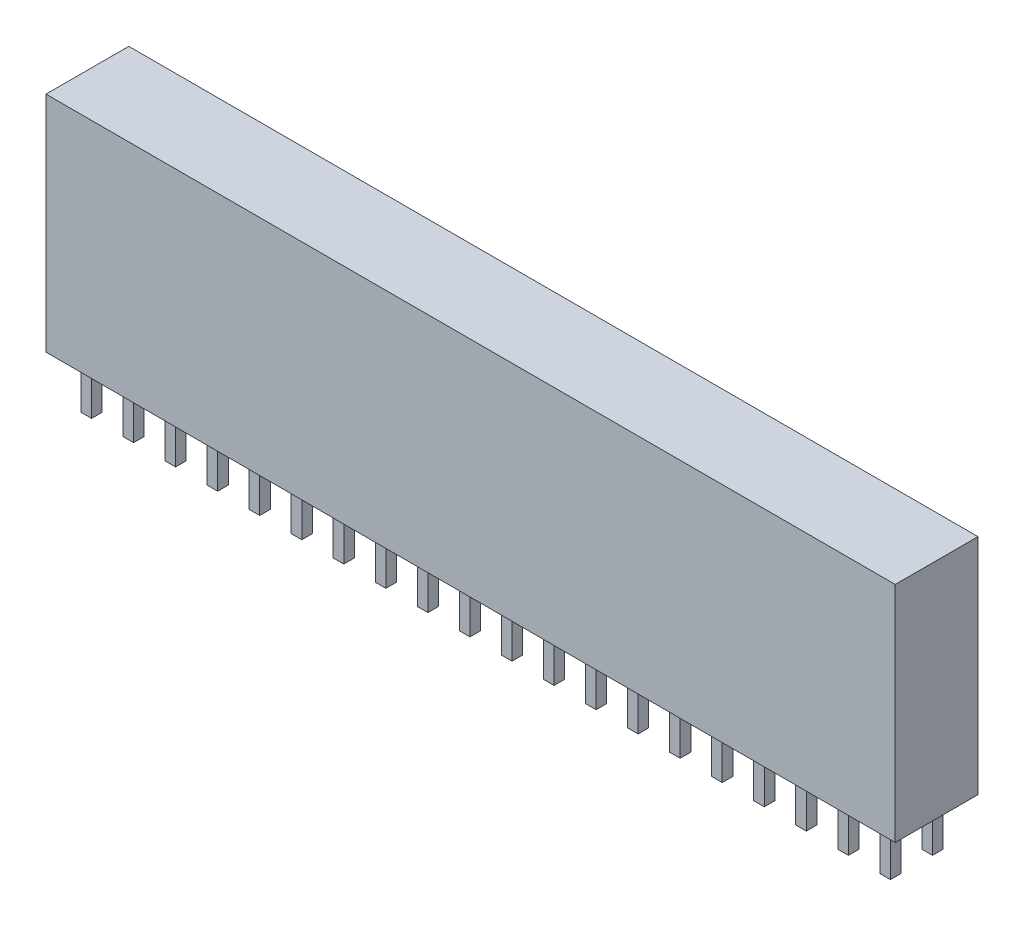
from build123d import *

# Parameters (mm, degrees)
SKETCH1_W           = 51.3
SKETCH1_H           = 5
BOSS_EXTRUDE1_DEPTH = 13.5
SKETCH2_W           = 0.64
SKETCH2_H           = 0.64
BOSS_EXTRUDE2_DEPTH = 3


with BuildPart() as part:
    # Sketch1 → Boss-Extrude1 (new body)
    with BuildSketch(Plane(origin=(0, 0, 0), x_dir=(1, 0, 0), z_dir=(0, 1, 0))):
        Rectangle(SKETCH1_W, SKETCH1_H)
    extrude(amount=BOSS_EXTRUDE1_DEPTH)

    # Sketch2 → Boss-Extrude2 (add)
    with BuildSketch(Plane.XZ):
        with Locations((-21.59, 1.27)):
            Rectangle(SKETCH2_W, SKETCH2_H)
        with Locations((-24.13, 1.27)):
            Rectangle(SKETCH2_W, SKETCH2_H)
        with Locations((-19.05, 1.27)):
            Rectangle(SKETCH2_W, SKETCH2_H)
        with Locations((-16.51, 1.27)):
            Rectangle(SKETCH2_W, SKETCH2_H)
        with Locations((-13.97, 1.27)):
            Rectangle(SKETCH2_W, SKETCH2_H)
        with Locations((-11.43, 1.27)):
            Rectangle(SKETCH2_W, SKETCH2_H)
        with Locations((-8.89, 1.27)):
            Rectangle(SKETCH2_W, SKETCH2_H)
        with Locations((-6.35, 1.27)):
            Rectangle(SKETCH2_W, SKETCH2_H)
        with Locations((-3.81, 1.27)):
            Rectangle(SKETCH2_W, SKETCH2_H)
        with Locations((-1.27, 1.27)):
            Rectangle(SKETCH2_W, SKETCH2_H)
        with Locations((24.13, 1.27)):
            Rectangle(SKETCH2_W, SKETCH2_H)
        with Locations((1.27, 1.27)):
            Rectangle(SKETCH2_W, SKETCH2_H)
        with Locations((3.81, 1.27)):
            Rectangle(SKETCH2_W, SKETCH2_H)
        with Locations((6.35, 1.27)):
            Rectangle(SKETCH2_W, SKETCH2_H)
        with Locations((8.89, 1.27)):
            Rectangle(SKETCH2_W, SKETCH2_H)
        with Locations((11.43, 1.27)):
            Rectangle(SKETCH2_W, SKETCH2_H)
        with Locations((13.97, 1.27)):
            Rectangle(SKETCH2_W, SKETCH2_H)
        with Locations((16.51, 1.27)):
            Rectangle(SKETCH2_W, SKETCH2_H)
        with Locations((19.05, 1.27)):
            Rectangle(SKETCH2_W, SKETCH2_H)
        with Locations((21.59, 1.27)):
            Rectangle(SKETCH2_W, SKETCH2_H)
        with Locations((21.59, -1.27)):
            Rectangle(SKETCH2_W, SKETCH2_H)
        with Locations((19.05, -1.27)):
            Rectangle(SKETCH2_W, SKETCH2_H)
        with Locations((16.51, -1.27)):
            Rectangle(SKETCH2_W, SKETCH2_H)
        with Locations((13.97, -1.27)):
            Rectangle(SKETCH2_W, SKETCH2_H)
        with Locations((11.43, -1.27)):
            Rectangle(SKETCH2_W, SKETCH2_H)
        with Locations((8.89, -1.27)):
            Rectangle(SKETCH2_W, SKETCH2_H)
        with Locations((6.35, -1.27)):
            Rectangle(SKETCH2_W, SKETCH2_H)
        with Locations((3.81, -1.27)):
            Rectangle(SKETCH2_W, SKETCH2_H)
        with Locations((1.27, -1.27)):
            Rectangle(SKETCH2_W, SKETCH2_H)
        with Locations((24.13, -1.27)):
            Rectangle(SKETCH2_W, SKETCH2_H)
        with Locations((-1.27, -1.27)):
            Rectangle(SKETCH2_W, SKETCH2_H)
        with Locations((-3.81, -1.27)):
            Rectangle(SKETCH2_W, SKETCH2_H)
        with Locations((-6.35, -1.27)):
            Rectangle(SKETCH2_W, SKETCH2_H)
        with Locations((-8.89, -1.27)):
            Rectangle(SKETCH2_W, SKETCH2_H)
        with Locations((-11.43, -1.27)):
            Rectangle(SKETCH2_W, SKETCH2_H)
        with Locations((-13.97, -1.27)):
            Rectangle(SKETCH2_W, SKETCH2_H)
        with Locations((-16.51, -1.27)):
            Rectangle(SKETCH2_W, SKETCH2_H)
        with Locations((-19.05, -1.27)):
            Rectangle(SKETCH2_W, SKETCH2_H)
        with Locations((-21.59, -1.27)):
            Rectangle(SKETCH2_W, SKETCH2_H)
        with Locations((-24.13, -1.27)):
            Rectangle(SKETCH2_W, SKETCH2_H)
    extrude(amount=BOSS_EXTRUDE2_DEPTH)


solid = part.part
